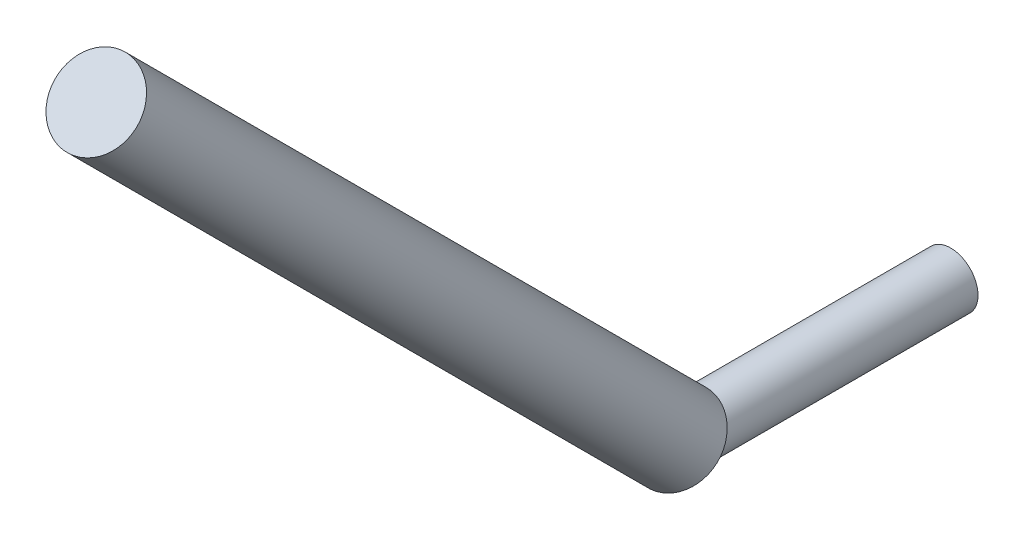
from build123d import *

# Parameters (mm, degrees)
SKETCH1_R           = 2
BOSS_EXTRUDE1_DEPTH = 20


with BuildPart() as part:
    # Sketch1 → Boss-Extrude1 (new body)
    with BuildSketch(Plane.XY):
        Circle(SKETCH1_R)
    extrude(amount=-BOSS_EXTRUDE1_DEPTH)

    # Sketch4 → Revolve1 (revolve)
    with BuildSketch(Plane(origin=(0, 0, 0), x_dir=(0, 0, -1), z_dir=(1, 0, 0))):
        Polygon((0, 0), (2.121320344, 2.121320344), (-40.305086528, 44.547727215), (-42.426406871, 42.426406871), align=None)
    revolve(axis=Axis((0, 0, 0), (0, 0.7071067811865488, 0.7071067811865464)))


solid = part.part
